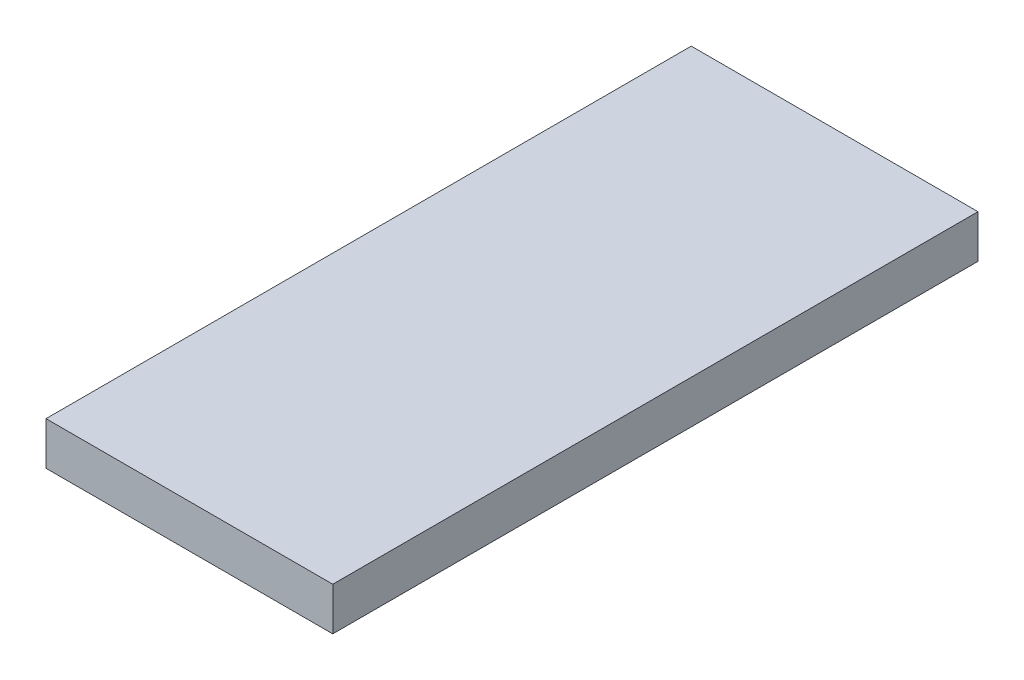
from build123d import *

# Parameters (mm, degrees)
SKETCH1_W           = 40
SKETCH1_H           = 90
BOSS_EXTRUDE1_DEPTH = 6


with BuildPart() as part:
    # Sketch1 → Boss-Extrude1 (new body)
    with BuildSketch(Plane(origin=(0, 0, 0), x_dir=(1, 0, 0), z_dir=(0, 1, 0))):
        with Locations((20, 45)):
            Rectangle(SKETCH1_W, SKETCH1_H)
    extrude(amount=BOSS_EXTRUDE1_DEPTH)


solid = part.part
